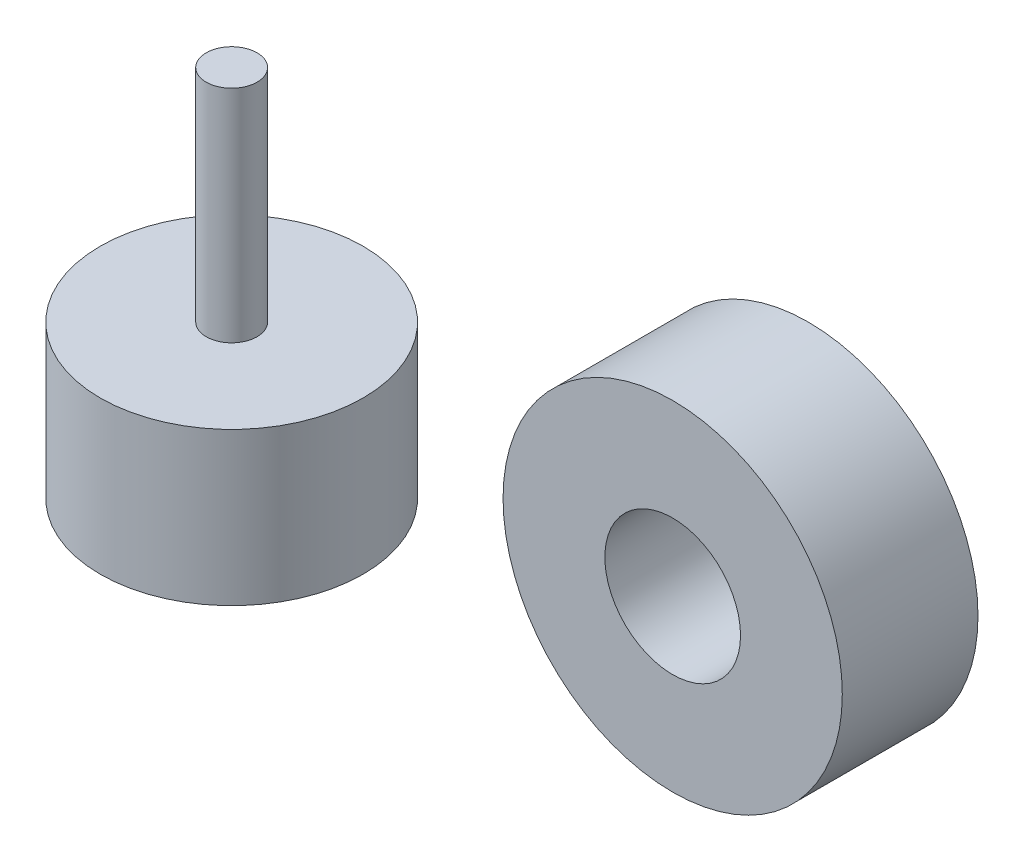
from build123d import *

# Parameters (mm, degrees)
SKETCH3_R           = 10
SKETCH3_R_2         = 4
ROD_HOLDER_DEPTH    = 4
SKETCH4_W           = 7.75
SKETCH4_H           = 9
SKETCH5_R           = 1.5
BOSS_EXTRUDE2_DEPTH = 13


with BuildPart() as part:
    # Sketch3 → rod holder (new, symmetric)
    with BuildSketch(Plane.XY):
        with Locations((30, 0)):
            Circle(SKETCH3_R)
        with Locations((30, 0)):
            Circle(SKETCH3_R_2, mode=Mode.SUBTRACT)
    extrude(amount=ROD_HOLDER_DEPTH, both=True)


with BuildPart() as body_2:
    # Sketch4 → Revolve5 (revolve)
    with BuildSketch(Plane.XY, mode=Mode.PRIVATE) as revolve5_sk:
        with Locations((3.875, -7.5)):
            Rectangle(SKETCH4_W, SKETCH4_H)
    revolve(revolve5_sk.sketch.rotate(Axis((0, -7.5, 0), (0, 1, 0)), 90), axis=Axis((0, -7.5, 0), (0, 1, 0)))

    # Sketch5 → Boss-Extrude2 (add)
    with BuildSketch(Plane(origin=(0, -3, 0), x_dir=(1, 0, 0), z_dir=(0, 1, 0))):
        with Locations(Location((0, 0, 0), (0, 0, 90))):
            Circle(SKETCH5_R)
    extrude(amount=BOSS_EXTRUDE2_DEPTH)


solid = Compound([part.part, body_2.part])
